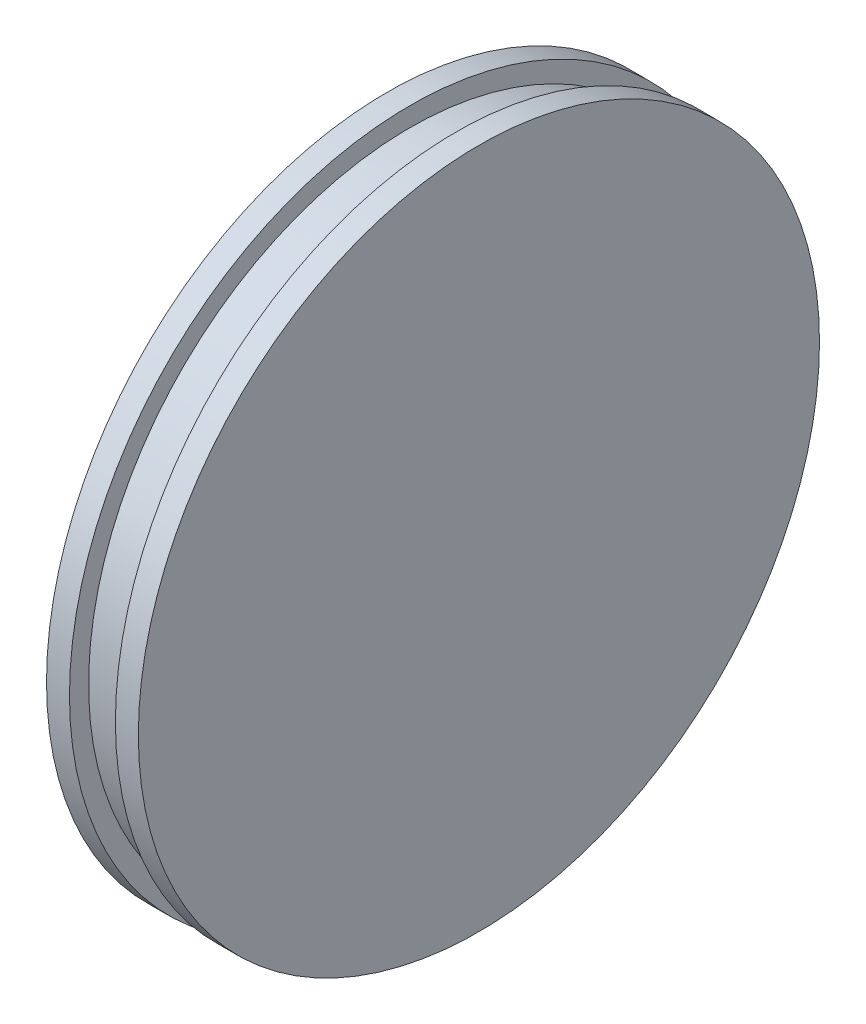
from build123d import *

# Parameters (mm, degrees)
SKETCH1_R           = 44.5
BOSS_EXTRUDE1_DEPTH = 12
SKETCH3_R           = 44.5
SKETCH3_R_2         = 42
CUT_EXTRUDE1_DEPTH  = 6
SKETCH4_R           = 17.5
CUT_EXTRUDE2_DEPTH  = 3


with BuildPart() as part:
    # Sketch1 → Boss-Extrude1 (new body)
    with BuildSketch(Plane(origin=(0, 0, 0), x_dir=(0, 0, -1), z_dir=(1, 0, 0))):
        Circle(SKETCH1_R)
    extrude(amount=BOSS_EXTRUDE1_DEPTH)

    # Sketch3 → Cut-Extrude1 (cut)
    with BuildSketch(Plane(origin=(3, 0, 0), x_dir=(0, 0, -1), z_dir=(1, 0, 0))):
        Circle(SKETCH3_R)
        Circle(SKETCH3_R_2, mode=Mode.SUBTRACT)
    extrude(amount=CUT_EXTRUDE1_DEPTH, mode=Mode.SUBTRACT)

    # Sketch4 → Cut-Extrude2 (cut)
    with BuildSketch(Plane.ZY):
        Circle(SKETCH4_R)
    extrude(amount=-CUT_EXTRUDE2_DEPTH, mode=Mode.SUBTRACT)


solid = part.part
